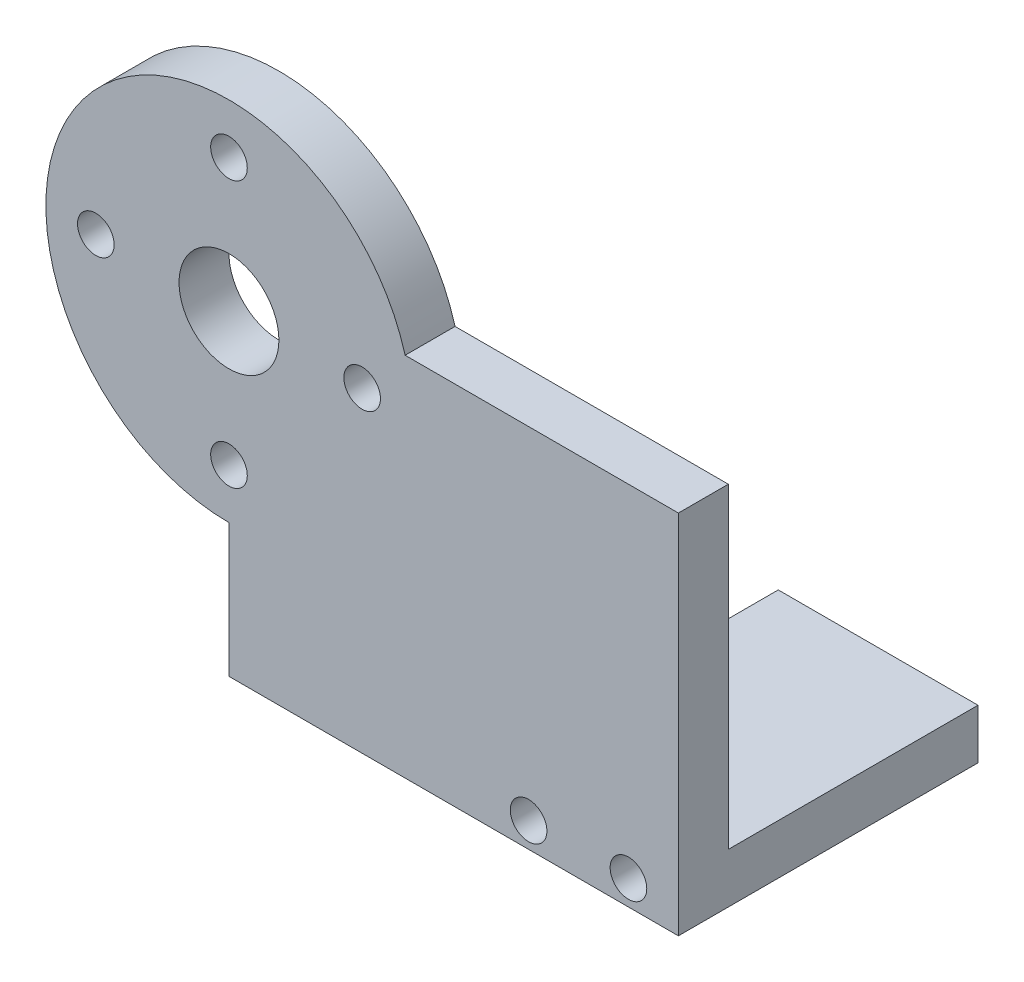
from build123d import *

# Parameters (mm, degrees)
STOCK_HORN_ATTACHMENT_START         = 15
STOCK_HORN_ATTACHMENT_PROFILE_R     = 11
STOCK_HORN_ATTACHMENT_DEPTH         = 3
FINGER_ARM_START                    = 15
FINGER_ARM_PROFILE_W                = 27
FINGER_ARM_PROFILE_H                = 22
FINGER_ARM_DEPTH                    = 3
DESCENDING_CONTACT_FINGER_PROFILE_W = 12
DESCENDING_CONTACT_FINGER_PROFILE_H = 3
DESCENDING_CONTACT_FINGER_DEPTH     = 18
HORN_CENTER_ACCESS_START            = -50
HORN_CENTER_ACCESS_PROFILE_R        = 3
HORN_CENTER_ACCESS_DEPTH            = 88.603191354
HORN_SCREWS_START                   = -50
HORN_SCREWS_PROFILE_R               = 1.1
HORN_SCREWS_DEPTH                   = 88.603191354
CONTACT_PAD_KEEPER_START            = -50
CONTACT_PAD_KEEPER_PROFILE_R        = 1.1
CONTACT_PAD_KEEPER_DEPTH            = 88.603191354


with BuildPart() as part:
    # Stock_horn_attachment_profile → Stock_horn_attachment (new body)
    with BuildSketch(Plane.XY.offset(STOCK_HORN_ATTACHMENT_START)):
        Circle(STOCK_HORN_ATTACHMENT_PROFILE_R)
    extrude(amount=STOCK_HORN_ATTACHMENT_DEPTH)

    # Finger_arm_profile → Finger_arm (add)
    with BuildSketch(Plane.XY.offset(FINGER_ARM_START)):
        with Locations((13.5, -8)):
            Rectangle(FINGER_ARM_PROFILE_W, FINGER_ARM_PROFILE_H)
    extrude(amount=FINGER_ARM_DEPTH)

    # Descending_contact_finger_profile → Descending_contact_finger (add)
    with BuildSketch(Plane.XY):
        with Locations((21, -17.5)):
            Rectangle(DESCENDING_CONTACT_FINGER_PROFILE_W, DESCENDING_CONTACT_FINGER_PROFILE_H)
    extrude(amount=DESCENDING_CONTACT_FINGER_DEPTH)

    # Horn_center_access_profile → Horn_center_access (cut, through all)
    with BuildSketch(Plane.XY.offset(HORN_CENTER_ACCESS_START)):
        Circle(HORN_CENTER_ACCESS_PROFILE_R)
    extrude(amount=HORN_CENTER_ACCESS_DEPTH, mode=Mode.SUBTRACT)

    # Horn_screws_profile → Horn_screws (cut, through all)
    with BuildSketch(Plane.XY.offset(HORN_SCREWS_START)):
        with Locations((0, -8)):
            Circle(HORN_SCREWS_PROFILE_R)
        with Locations((0, 8)):
            Circle(HORN_SCREWS_PROFILE_R)
        with Locations((-8, 0)):
            Circle(HORN_SCREWS_PROFILE_R)
        with Locations((8, 0)):
            Circle(HORN_SCREWS_PROFILE_R)
    extrude(amount=HORN_SCREWS_DEPTH, mode=Mode.SUBTRACT)

    # Contact_pad_keeper_profile → Contact_pad_keeper (cut, through all)
    with BuildSketch(Plane.XY.offset(CONTACT_PAD_KEEPER_START)):
        with Locations(Location((18, -17.5, 0), (0, 0, 180))):
            Circle(CONTACT_PAD_KEEPER_PROFILE_R)
        with Locations(Location((24, -17.5, 0), (0, 0, 180))):
            Circle(CONTACT_PAD_KEEPER_PROFILE_R)
    extrude(amount=CONTACT_PAD_KEEPER_DEPTH, mode=Mode.SUBTRACT)


solid = part.part
